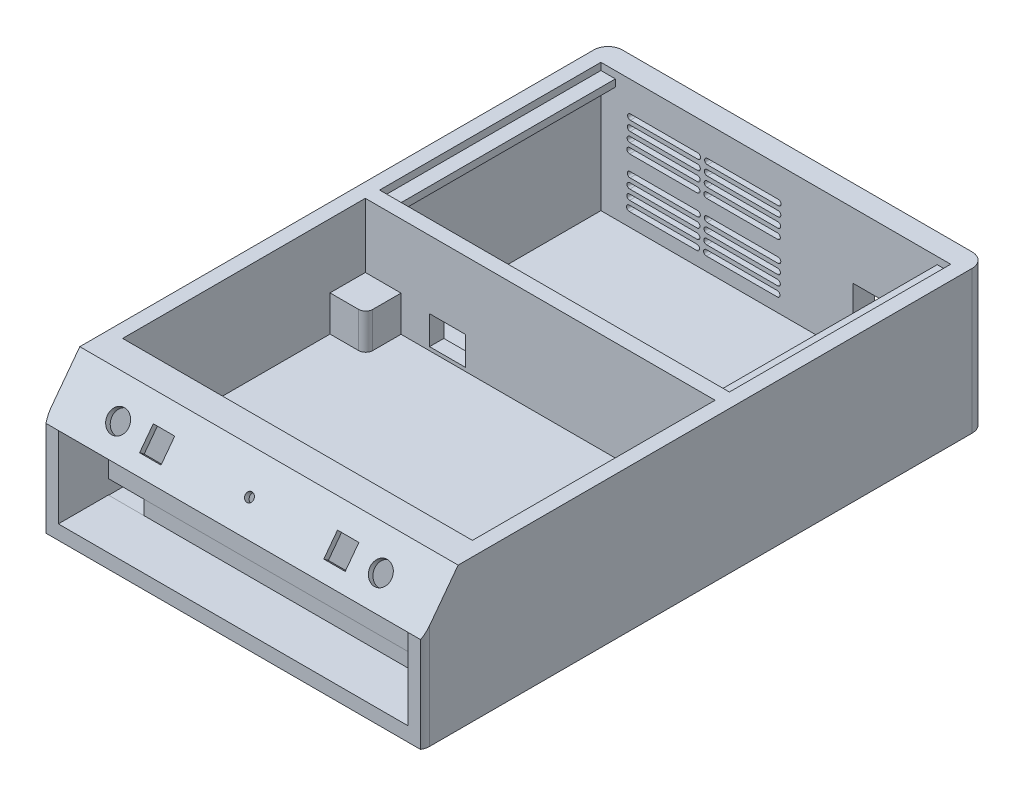
from build123d import *

# Parameters (mm, degrees)
BOSS_EXTRUDE2_DEPTH      = 100
SKETCH4_W                = 245
SKETCH4_H                = 170
CUT_EXTRUDE2_DEPTH       = 70
CUT_EXTRUDE12_DEPTH      = 434.077648927
CUT_EXTRUDE12_DEPTH_BACK = 434.077648927
CUT_EXTRUDE13_DEPTH      = 122.5
CUT_EXTRUDE14_DEPTH      = 122.5
SKETCH16_W               = 43.138722298
SKETCH16_H               = 44.253532058
CUT_EXTRUDE15_DEPTH      = 30
SKETCH17_R               = 2.952889484
SKETCH17_R_2             = 7.5
SKETCH17_W               = 15
SKETCH17_H               = 16
CUT_EXTRUDE16_DEPTH      = 10
BOSS_EXTRUDE3_DEPTH      = 25
SKETCH19_W               = 25
SKETCH19_H               = 20
CUT_EXTRUDE17_DEPTH      = 15
SKETCH21_W               = 195.080232819
SKETCH21_H               = 190
BOSS_EXTRUDE9_DEPTH      = 10
SKETCH22_W               = 265
SKETCH22_H               = 73.333333333
CUT_EXTRUDE18_DEPTH      = 5
SKETCH23_W               = 245
SKETCH23_H               = 56.666666667
CUT_EXTRUDE19_DEPTH      = 5
SKETCH25_W               = 245
SKETCH25_H               = 155
CUT_EXTRUDE20_DEPTH      = 5
SKETCH26_W               = 225.395956853
SKETCH26_H               = 155
CUT_EXTRUDE21_DEPTH      = 5


with BuildPart() as part:
    # Sketch1 → Boss-Extrude2 (new body)
    with BuildSketch(Plane(origin=(0, 0, 0), x_dir=(1, 0, 0), z_dir=(0, 1, 0))):
        with BuildLine():
            Line((0, -10), (0, -390))
            ThreePointArc((0, -390), (2.928932188, -397.071067812), (10, -400))
            Line((10, -400), (255, -400))
            ThreePointArc((255, -400), (262.071067812, -397.071067812), (265, -390))
            Line((265, -390), (265, -10))
            ThreePointArc((265, -10), (262.071067812, -2.928932188), (255, 0))
            Line((255, 0), (10, 0))
            ThreePointArc((10, 0), (2.928932188, -2.928932188), (0, -10))
        make_face()
    extrude(amount=BOSS_EXTRUDE2_DEPTH)

    # Sketch4 → Cut-Extrude2 (cut)
    with BuildSketch(Plane(origin=(0, 100, 0), x_dir=(1, 0, 0), z_dir=(0, 1, 0))):
        with Locations((132.5, -265)):
            Rectangle(SKETCH4_W, SKETCH4_H)
    extrude(amount=-CUT_EXTRUDE2_DEPTH, mode=Mode.SUBTRACT)

    # Sketch10 → Cut-Extrude12 (cut, two sides: drawn at the far end of the back side and taken through both)
    with BuildSketch(Plane(origin=(132.5, 0, 0), x_dir=(0, 0, -1), z_dir=(1, 0, 0)).offset(-CUT_EXTRUDE12_DEPTH_BACK)):
        Polygon((-400, 60), (-370, 100), (-400, 100), align=None)
    extrude(amount=CUT_EXTRUDE12_DEPTH + CUT_EXTRUDE12_DEPTH_BACK, mode=Mode.SUBTRACT)

    # Sketch14 → Cut-Extrude13 (cut, symmetric)
    with BuildSketch(Plane(origin=(132.5, 0, 0), x_dir=(0, 0, -1), z_dir=(1, 0, 0))):
        Polygon((-390, 10), (-360, 10), (-360, 96), (-368, 96), (-390, 66.666666667), align=None)
    extrude(amount=CUT_EXTRUDE13_DEPTH, both=True, mode=Mode.SUBTRACT)

    # Sketch15 → Cut-Extrude14 (cut, symmetric)
    with BuildSketch(Plane(origin=(132.5, 0, 0), x_dir=(0, 0, -1), z_dir=(1, 0, 0))):
        Polygon((-360, 9.784104138), (-360, 20), (-170, 20), (-170, 90), (-15, 90), (-15, 10), align=None)
    extrude(amount=CUT_EXTRUDE14_DEPTH, both=True, mode=Mode.SUBTRACT)

    # Sketch16 → Cut-Extrude15 (cut)
    with BuildSketch(Plane(origin=(0, 0, 0), x_dir=(-1, 0, 0), z_dir=(0, 0, -1))):
        with BuildLine():
            Line((-134.270613799, 79.007587215), (-84.597699843, 79.007587215))
            ThreePointArc((-84.597699843, 79.007587215), (-82.662391507, 77.072278879), (-84.597699843, 75.136970544))
            Line((-84.597699843, 75.136970544), (-134.270613799, 75.136970544))
            ThreePointArc((-134.270613799, 75.136970544), (-136.205922135, 77.072278879), (-134.270613799, 79.007587215))
        make_face()
        with BuildLine():
            Line((-77.931637797, 79.007587215), (-30.624100696, 79.007587215))
            ThreePointArc((-30.624100696, 79.007587215), (-28.68879236, 77.072278879), (-30.624100696, 75.136970544))
            Line((-30.624100696, 75.136970544), (-77.931637797, 75.136970544))
            ThreePointArc((-77.931637797, 75.136970544), (-79.866946133, 77.072278879), (-77.931637797, 79.007587215))
        make_face()
        with BuildLine():
            Line((-134.062529734, 72.12649091), (-84.389615778, 72.12649091))
            ThreePointArc((-84.389615778, 72.12649091), (-82.454307442, 70.191182574), (-84.389615778, 68.255874238))
            Line((-84.389615778, 68.255874238), (-134.062529734, 68.255874238))
            ThreePointArc((-134.062529734, 68.255874238), (-135.99783807, 70.191182574), (-134.062529734, 72.12649091))
        make_face()
        with BuildLine():
            Line((-77.723553732, 72.12649091), (-30.416016631, 72.12649091))
            ThreePointArc((-30.416016631, 72.12649091), (-28.480708295, 70.191182574), (-30.416016631, 68.255874238))
            Line((-30.416016631, 68.255874238), (-77.723553732, 68.255874238))
            ThreePointArc((-77.723553732, 68.255874238), (-79.658862068, 70.191182574), (-77.723553732, 72.12649091))
        make_face()
        with BuildLine():
            Line((-133.955012604, 65.245394604), (-84.282098648, 65.245394604))
            ThreePointArc((-84.282098648, 65.245394604), (-82.346790312, 63.310086268), (-84.282098648, 61.374777932))
            Line((-84.282098648, 61.374777932), (-133.955012604, 61.374777932))
            ThreePointArc((-133.955012604, 61.374777932), (-135.89032094, 63.310086268), (-133.955012604, 65.245394604))
        make_face()
        with BuildLine():
            Line((-77.616036602, 65.245394604), (-30.308499501, 65.245394604))
            ThreePointArc((-30.308499501, 65.245394604), (-28.373191165, 63.310086268), (-30.308499501, 61.374777932))
            Line((-30.308499501, 61.374777932), (-77.616036602, 61.374777932))
            ThreePointArc((-77.616036602, 61.374777932), (-79.551344938, 63.310086268), (-77.616036602, 65.245394604))
        make_face()
        with BuildLine():
            Line((-133.746928539, 58.364298299), (-84.074014583, 58.364298299))
            ThreePointArc((-84.074014583, 58.364298299), (-82.138706247, 56.428989963), (-84.074014583, 54.493681627))
            Line((-84.074014583, 54.493681627), (-133.746928539, 54.493681627))
            ThreePointArc((-133.746928539, 54.493681627), (-135.682236875, 56.428989963), (-133.746928539, 58.364298299))
        make_face()
        with BuildLine():
            Line((-77.407952537, 58.364298299), (-30.100415436, 58.364298299))
            ThreePointArc((-30.100415436, 58.364298299), (-28.1651071, 56.428989963), (-30.100415436, 54.493681627))
            Line((-30.100415436, 54.493681627), (-77.407952537, 54.493681627))
            ThreePointArc((-77.407952537, 54.493681627), (-79.343260873, 56.428989963), (-77.407952537, 58.364298299))
        make_face()
        with BuildLine():
            Line((-134.048629345, 43.957002909), (-84.375715389, 43.957002909))
            ThreePointArc((-84.375715389, 43.957002909), (-82.440407053, 42.021694573), (-84.375715389, 40.086386237))
            Line((-84.375715389, 40.086386237), (-134.048629345, 40.086386237))
            ThreePointArc((-134.048629345, 40.086386237), (-135.983937681, 42.021694573), (-134.048629345, 43.957002909))
        make_face()
        with BuildLine():
            Line((-77.709653343, 43.957002909), (-30.402116242, 43.957002909))
            ThreePointArc((-30.402116242, 43.957002909), (-28.466807907, 42.021694573), (-30.402116242, 40.086386237))
            Line((-30.402116242, 40.086386237), (-77.709653343, 40.086386237))
            ThreePointArc((-77.709653343, 40.086386237), (-79.644961679, 42.021694573), (-77.709653343, 43.957002909))
        make_face()
        with BuildLine():
            Line((-133.84054528, 37.075906603), (-84.167631324, 37.075906603))
            ThreePointArc((-84.167631324, 37.075906603), (-82.232322988, 35.140598267), (-84.167631324, 33.205289932))
            Line((-84.167631324, 33.205289932), (-133.84054528, 33.205289932))
            ThreePointArc((-133.84054528, 33.205289932), (-135.775853616, 35.140598267), (-133.84054528, 37.075906603))
        make_face()
        with BuildLine():
            Line((-77.501569278, 37.075906603), (-30.194032177, 37.075906603))
            ThreePointArc((-30.194032177, 37.075906603), (-28.258723841, 35.140598267), (-30.194032177, 33.205289932))
            Line((-30.194032177, 33.205289932), (-77.501569278, 33.205289932))
            ThreePointArc((-77.501569278, 33.205289932), (-79.436877614, 35.140598267), (-77.501569278, 37.075906603))
        make_face()
        with BuildLine():
            Line((-133.73302815, 30.194810298), (-84.060114194, 30.194810298))
            ThreePointArc((-84.060114194, 30.194810298), (-82.124805858, 28.259501962), (-84.060114194, 26.324193626))
            Line((-84.060114194, 26.324193626), (-133.73302815, 26.324193626))
            ThreePointArc((-133.73302815, 26.324193626), (-135.668336486, 28.259501962), (-133.73302815, 30.194810298))
        make_face()
        with BuildLine():
            Line((-77.394052148, 30.194810298), (-30.086515047, 30.194810298))
            ThreePointArc((-30.086515047, 30.194810298), (-28.151206712, 28.259501962), (-30.086515047, 26.324193626))
            Line((-30.086515047, 26.324193626), (-77.394052148, 26.324193626))
            ThreePointArc((-77.394052148, 26.324193626), (-79.329360484, 28.259501962), (-77.394052148, 30.194810298))
        make_face()
        with BuildLine():
            Line((-133.524944085, 23.313713992), (-83.852030129, 23.313713992))
            ThreePointArc((-83.852030129, 23.313713992), (-81.916721793, 21.378405656), (-83.852030129, 19.44309732))
            Line((-83.852030129, 19.44309732), (-133.524944085, 19.44309732))
            ThreePointArc((-133.524944085, 19.44309732), (-135.460252421, 21.378405656), (-133.524944085, 23.313713992))
        make_face()
        with BuildLine():
            Line((-77.185968083, 23.313713992), (-29.878430982, 23.313713992))
            ThreePointArc((-29.878430982, 23.313713992), (-27.943122646, 21.378405656), (-29.878430982, 19.44309732))
            Line((-29.878430982, 19.44309732), (-77.185968083, 19.44309732))
            ThreePointArc((-77.185968083, 19.44309732), (-79.121276419, 21.378405656), (-77.185968083, 23.313713992))
        make_face()
        with Locations((-208.203996246, 32.126766029)):
            Rectangle(SKETCH16_W, SKETCH16_H)
    extrude(amount=-CUT_EXTRUDE15_DEPTH, mode=Mode.SUBTRACT)

    # Sketch17 → Cut-Extrude16 (cut)
    with BuildSketch(Plane(origin=(0, 213.6, 284.8), x_dir=(1, 0, 0), z_dir=(0, 0.5999999999999998, 0.8000000000000004))):
        with Locations(Location((132.5, -164.727732251, 0), (0, 0, 270))):
            Circle(SKETCH17_R)
        with Locations(Location((40.5, -164.727732251, 0), (0, 0, 270))):
            Circle(SKETCH17_R_2)
        with Locations(Location((224.5, -164.727732251, 0), (0, 0, 270))):
            Circle(SKETCH17_R_2)
        with Locations((68, -165)):
            Rectangle(SKETCH17_W, SKETCH17_H)
        with Locations((197, -165)):
            Rectangle(SKETCH17_W, SKETCH17_H)
    extrude(amount=-CUT_EXTRUDE16_DEPTH, mode=Mode.SUBTRACT)

    # Sketch18 → Boss-Extrude3 (add)
    with BuildSketch(Plane(origin=(0, 30, 0), x_dir=(1, 0, 0), z_dir=(0, 1, 0))):
        with BuildLine():
            Line((10, -180), (10, -204.729927007))
            Line((10, -204.729927007), (30, -204.729927007))
            ThreePointArc((30, -204.729927007), (33.43872324, -203.359690427), (34.99270073, -200))
            Line((34.99270073, -200), (34.99270073, -180))
            Line((34.99270073, -180), (10, -180))
        make_face()
        with BuildLine():
            Line((255, -350), (255, -324.14910859))
            Line((255, -324.14910859), (235, -324.14910859))
            ThreePointArc((235, -324.14910859), (231.175444009, -325.928429861), (230.072933549, -330))
            Line((230.072933549, -330), (230.072933549, -350))
            Line((230.072933549, -350), (255, -350))
        make_face()
    extrude(amount=BOSS_EXTRUDE3_DEPTH)

    # Sketch19 → Cut-Extrude17 (cut)
    with BuildSketch(Plane.XY.offset(180)):
        with Locations((67.49270073, 42.5)):
            Rectangle(SKETCH19_W, SKETCH19_H)
    extrude(amount=-CUT_EXTRUDE17_DEPTH, mode=Mode.SUBTRACT)

    # Sketch22 → Cut-Extrude18 (cut)
    with BuildSketch(Plane.XY.offset(400)):
        with Locations((132.5, 36.666666666)):
            Rectangle(SKETCH22_W, SKETCH22_H)
    extrude(amount=-CUT_EXTRUDE18_DEPTH, mode=Mode.SUBTRACT)

    # Sketch23 → Cut-Extrude19 (cut)
    with BuildSketch(Plane.XY.offset(395)):
        with Locations((132.5, 38.333333334)):
            Rectangle(SKETCH23_W, SKETCH23_H)
    extrude(amount=-CUT_EXTRUDE19_DEPTH, mode=Mode.SUBTRACT)

    # Sketch25 → Cut-Extrude20 (cut)
    with BuildSketch(Plane(origin=(0, 100, 0), x_dir=(1, 0, 0), z_dir=(0, 1, 0))):
        with Locations((132.5, -92.5)):
            Rectangle(SKETCH25_W, SKETCH25_H)
    extrude(amount=-CUT_EXTRUDE20_DEPTH, mode=Mode.SUBTRACT)

    # Sketch26 → Cut-Extrude21 (cut)
    with BuildSketch(Plane(origin=(0, 95, 0), x_dir=(1, 0, 0), z_dir=(0, 1, 0))):
        with Locations((132.844011757, -92.5)):
            Rectangle(SKETCH26_W, SKETCH26_H)
    extrude(amount=-CUT_EXTRUDE21_DEPTH, mode=Mode.SUBTRACT)


with BuildPart() as body_2:
    # Sketch21 → Boss-Extrude9 (new body)
    with BuildSketch(Plane.XZ.offset(-20)):
        with Locations((132.53281714, 265)):
            Rectangle(SKETCH21_W, SKETCH21_H)
    extrude(amount=BOSS_EXTRUDE9_DEPTH)


solid = Compound([part.part, body_2.part])
